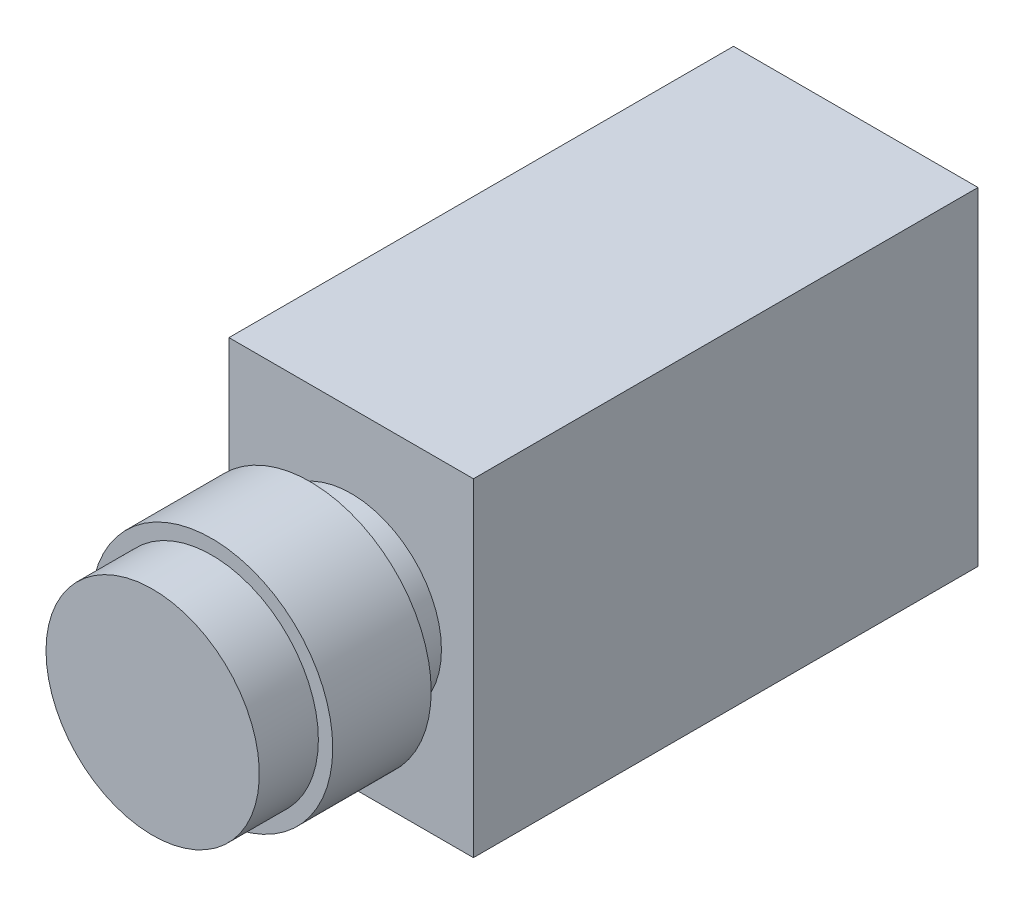
from build123d import *

# Parameters (mm, degrees)
SKETCH1_R           = 14.75
BOSS_EXTRUDE1_DEPTH = 12
SKETCH2_R           = 13
BOSS_EXTRUDE2_DEPTH = 19.2
SKETCH4_R           = 11
BOSS_EXTRUDE4_DEPTH = 61.5
BOSS_EXTRUDE3_START = 5
SKETCH3_W           = 29.8
SKETCH3_H           = 40
BOSS_EXTRUDE3_DEPTH = 61.5


with BuildPart() as part:
    # Sketch1 → Boss-Extrude1 (new body)
    with BuildSketch(Plane.XY):
        Circle(SKETCH1_R)
    extrude(amount=BOSS_EXTRUDE1_DEPTH)

    # Sketch2 → Boss-Extrude2 (add)
    with BuildSketch(Plane(origin=(0, 0, 0), x_dir=(-1, 0, 0), z_dir=(0, 0, -1))):
        Circle(SKETCH2_R)
    extrude(amount=-BOSS_EXTRUDE2_DEPTH)

    # Sketch4 → Boss-Extrude4 (add)
    with BuildSketch(Plane(origin=(0, 0, 0), x_dir=(-1, 0, 0), z_dir=(0, 0, -1))):
        with Locations(Location((0, 0, 0), (0, 0, 180))):
            Circle(SKETCH4_R)
    extrude(amount=BOSS_EXTRUDE4_DEPTH)


with BuildPart() as body_2:
    # Sketch3 → Boss-Extrude3 (new body)
    with BuildSketch(Plane(origin=(0, 0, 0), x_dir=(-1, 0, 0), z_dir=(0, 0, -1)).offset(BOSS_EXTRUDE3_START)):
        Rectangle(SKETCH3_W, SKETCH3_H)
    extrude(amount=BOSS_EXTRUDE3_DEPTH)


solid = Compound([part.part, body_2.part])
